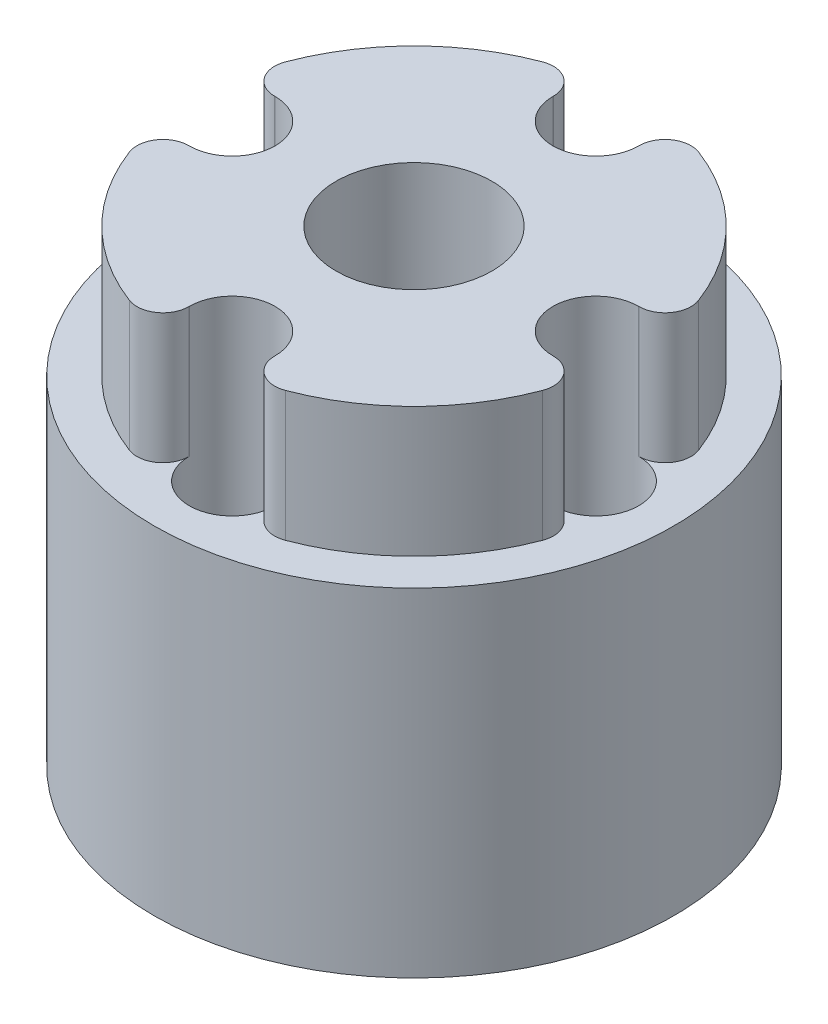
from build123d import *

# Parameters (mm, degrees)
SKETCH_1_R                       = 10
EXTRUDE_358_DEPTH                = 13
SKETCH_2_R                       = 8.5
EXTRUDE_447_DEPTH                = 5
SKETCH_3_R                       = 3
CUT_EXTRUDE_558_DEPTH            = 23.891046285
CUT_EXTRUDE_START                = -5
CUT_EXTRUDE_755_DEPTH            = 5
SKETCH_5_R                       = 1.65
CUT_EXTRUDE_910_DEPTH            = 20.209372712
FILLET_1_R                       = 1
PATTERN_CIRCULAR_1_COUNT         = 4
FILLET_1_OF_PATTERN_CIRCULAR_1_R = 1


with BuildPart() as part:
    # Эскиз1 → Extrude 358 (new body)
    with BuildSketch(Plane(origin=(0, 0, 0), x_dir=(1, 0, 0), z_dir=(0, 1, 0))):
        with Locations(Location((0, 0, 0), (0, 0, 90))):
            Circle(SKETCH_1_R)
    extrude(amount=EXTRUDE_358_DEPTH)

    # Эскиз2 → Extrude 447 (add)
    with BuildSketch(Plane(origin=(0, 13, 0), x_dir=(1, 0, 0), z_dir=(0, 1, 0))):
        with Locations(Location((0, 0, 0), (0, 0, 270))):
            Circle(SKETCH_2_R)
    extrude(amount=EXTRUDE_447_DEPTH)

    # Эскиз3 → Cut-Extrude 558 (cut, through all)
    with BuildSketch(Plane(origin=(0, 18, 0), x_dir=(1, 0, 0), z_dir=(0, 1, 0))):
        with Locations(Location((0, 0, 0), (0, 0, 270))):
            Circle(SKETCH_3_R)
    extrude(amount=-CUT_EXTRUDE_558_DEPTH, mode=Mode.SUBTRACT)

    # Эскиз4 → Cut-Extrude 755 (cut)
    with BuildSketch(Plane(origin=(0, 18, 0), x_dir=(1, 0, 0), z_dir=(0, 1, 0)).offset(CUT_EXTRUDE_START)):
        with BuildLine():
            Line((-1.65, 7), (-1.65, 8.338315178))
            ThreePointArc((-1.65, 8.338315178), (0, 8.5), (1.65, 8.338315178))
            Line((1.65, 8.338315178), (1.65, 7))
            ThreePointArc((1.65, 7), (0, 5.35), (-1.65, 7))
        make_face()
    cut_extrude_755 = extrude(amount=CUT_EXTRUDE_755_DEPTH, mode=Mode.SUBTRACT)

    # Эскиз5 → Cut-Extrude 910 (cut, through all)
    with BuildSketch(Plane(origin=(0, 13, 0), x_dir=(1, 0, 0), z_dir=(0, 1, 0))):
        with Locations(Location((0, 7, 0), (0, 0, 270))):
            Circle(SKETCH_5_R)
    cut_extrude_910 = extrude(amount=-CUT_EXTRUDE_910_DEPTH, mode=Mode.SUBTRACT)

    # Скругление1
    fillet_1_edges = [part.edges().sort_by_distance(p)[0] for p in [
        (-1.65, 15.5, -8.338315178),
        (1.65, 15.5, -8.338315178),
    ]]
    fillet(fillet_1_edges, radius=FILLET_1_R)

    # Круговой массив1: Cut-Extrude 755, Cut-Extrude 910 ×4 about axis
    pattern_circular_1_axis = Axis((0, 0, 0), (0, 1, 0))
    add([cut_extrude_755.rotate(pattern_circular_1_axis, i * 360 / PATTERN_CIRCULAR_1_COUNT) for i in range(1, PATTERN_CIRCULAR_1_COUNT)], mode=Mode.SUBTRACT)
    add([cut_extrude_910.rotate(pattern_circular_1_axis, i * 360 / PATTERN_CIRCULAR_1_COUNT) for i in range(1, PATTERN_CIRCULAR_1_COUNT)], mode=Mode.SUBTRACT)

    # Скругление1 of Круговой массив1
    fillet_1_of_pattern_circular_1_edges = [part.edges().sort_by_distance(p)[0] for p in [
        (-8.338315178, 15.5, 1.65),
        (-8.338315178, 15.5, -1.65),
        (1.65, 15.5, 8.338315178),
        (-1.65, 15.5, 8.338315178),
        (8.338315178, 15.5, -1.65),
        (8.338315178, 15.5, 1.65),
    ]]
    fillet(fillet_1_of_pattern_circular_1_edges, radius=FILLET_1_OF_PATTERN_CIRCULAR_1_R)


solid = part.part
